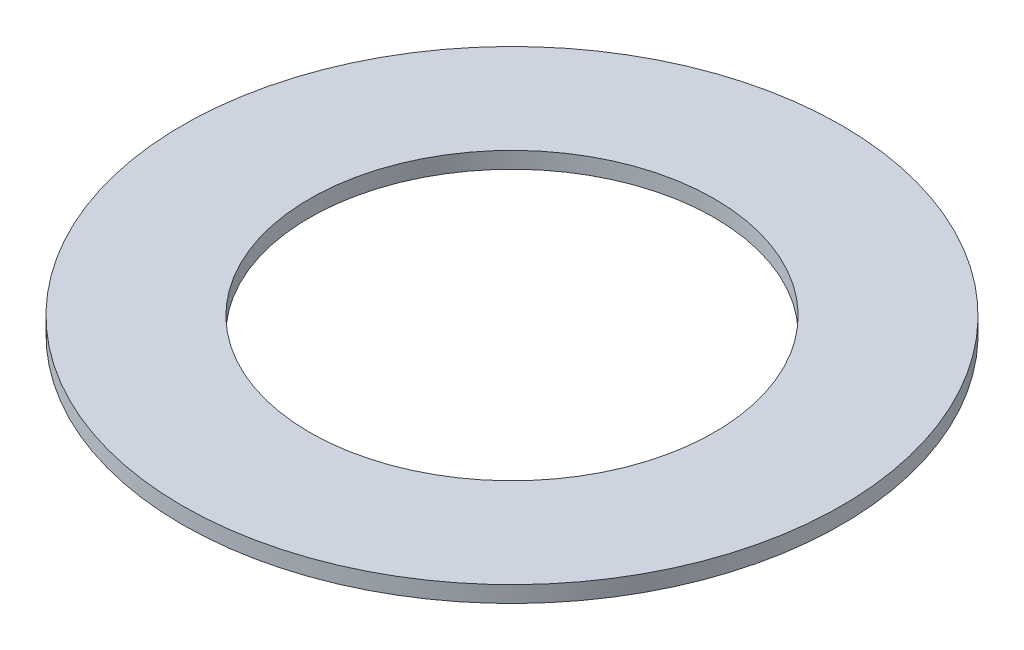
from build123d import *

# Parameters (mm, degrees)
SKETCH1_R           = 80.7
SKETCH1_R_2         = 49.55
BOSS_EXTRUDE1_DEPTH = 4


with BuildPart() as part:
    # Sketch1 → Boss-Extrude1 (new body)
    with BuildSketch(Plane(origin=(0, 0, 0), x_dir=(1, 0, 0), z_dir=(0, 1, 0))):
        with Locations(Location((0, 0, 0), (0, 0, 270))):
            Circle(SKETCH1_R)
        with Locations(Location((0, 0, 0), (0, 0, 270))):
            Circle(SKETCH1_R_2, mode=Mode.SUBTRACT)
    extrude(amount=BOSS_EXTRUDE1_DEPTH)


solid = part.part
